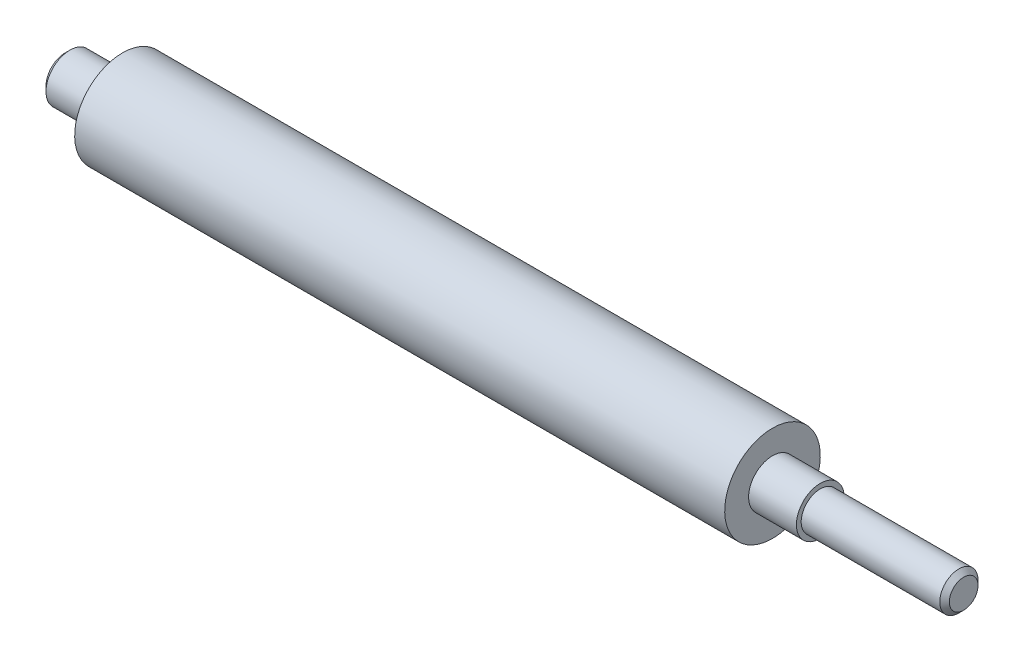
from build123d import *

# Parameters (mm, degrees)
CHAMFER1_SIZE = 0.5


with BuildPart() as part:
    # Sketch1 → Revolve1 (revolve)
    with BuildSketch(Plane.XY):
        Polygon((0, 0), (0, 2.5), (6, 2.5), (6, 5), (74, 5), (74, 2.5), (79, 2.5), (79, 2), (94, 2), (94, 0), align=None)
    revolve(axis=Axis((94, 0, 0), (-1, 0, 0)))

    # Chamfer1
    chamfer1_edges = [part.edges().sort_by_distance(p)[0] for p in [
        (0, -2.5, 0),
        (94, -2, 0),
    ]]
    chamfer(chamfer1_edges, length=CHAMFER1_SIZE)


solid = part.part
